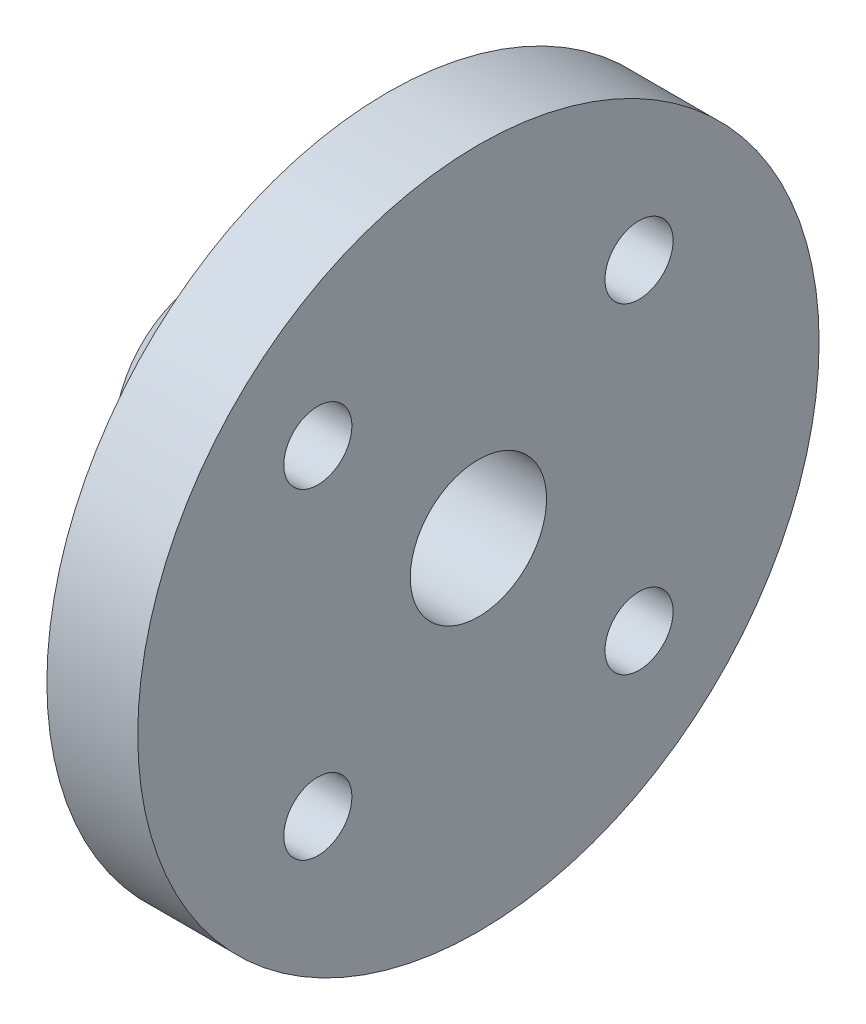
from build123d import *

# Parameters (mm, degrees)
SKETCH2_R          = 1.5
CUT_EXTRUDE1_DEPTH = 5
SKETCH3_R          = 1.5
CUT_EXTRUDE2_DEPTH = 25.372115263


with BuildPart() as part:
    # Sketch1 → Revolve1 (revolve)
    with BuildSketch(Plane.XY, mode=Mode.PRIVATE) as revolve1_sk:
        Polygon((12, 3), (12, 15), (8, 15), (8, 5), (1, 5), (0, 4), (0, 3), align=None)
    revolve(revolve1_sk.sketch.rotate(Axis((0, 0, 0), (1, 0, 0)), 90), axis=Axis((0, 0, 0), (1, 0, 0)))

    # Sketch2 → Cut-Extrude1 (cut)
    with BuildSketch(Plane(origin=(0, 0, 0), x_dir=(1, 0, 0), z_dir=(0, 1, 0))):
        with Locations(Location((4, 0, 0), (0, 0, 270))):
            Circle(SKETCH2_R)
    extrude(amount=-CUT_EXTRUDE1_DEPTH, mode=Mode.SUBTRACT)

    # Sketch3 → Cut-Extrude2 (cut, through all)
    with BuildSketch(Plane(origin=(12, 0, 0), x_dir=(0, 0, -1), z_dir=(1, 0, 0))):
        with Locations((-7.071067812, 7.071067812)):
            Circle(SKETCH3_R)
        with Locations((7.071067812, 7.071067812)):
            Circle(SKETCH3_R)
        with Locations((7.071067812, -7.071067812)):
            Circle(SKETCH3_R)
        with Locations((-7.071067812, -7.071067812)):
            Circle(SKETCH3_R)
    extrude(amount=-CUT_EXTRUDE2_DEPTH, mode=Mode.SUBTRACT)


solid = part.part
